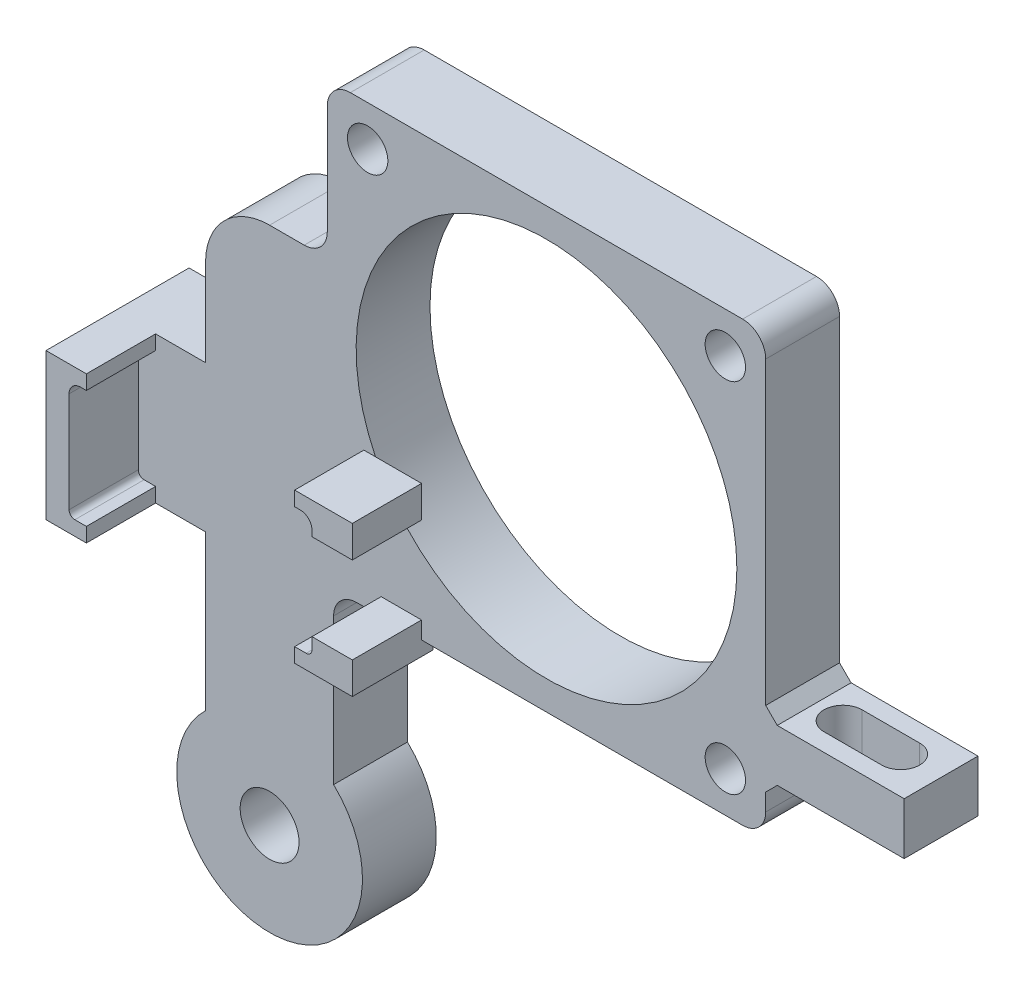
from build123d import *
from OCP.BRepFilletAPI import BRepFilletAPI_MakeFillet

# Parameters (mm, degrees)
SKETCH1_R                 = 2.55
SKETCH1_R_2               = 1.75
SKETCH1_R_3               = 12.5
BOSS_EXTRUDE3_DEPTH       = 6.4
SKETCH1_5_R               = 2.55
BOSS_EXTRUDE2_DEPTH       = 1
CUT_EXTRUDE1_DEPTH        = 10
FILLET2_R                 = 2
CHAMFER2_SIZE             = 1
FILLET1_R                 = 2
SKETCH5_R                 = 16.5
CUT_EXTRUDE2_DEPTH        = 10
SKETCH6_W                 = 4.33
SKETCH6_H                 = 1.25
BOSS_EXTRUDE5_DEPTH       = 6.4
BOSS_EXTRUDE8_DEPTH       = 6
BOSS_EXTRUDE13_DEPTH      = 6
BOSS_EXTRUDE13_DEPTH_BACK = 1
FILLET3_R1                = 1
FILLET3_R2                = 0.5


with BuildPart() as part:
    # Sketch1 → Boss-Extrude3 (new body)
    with BuildSketch(Plane.XY):
        with BuildLine():
            ThreePointArc((-5.55, 5.830951895), (0, -8.05), (5.55, 5.830951895))
            Line((5.55, 5.830951895), (5.55, 20.5))
            Line((5.55, 20.5), (43, 20.5))
            Line((43, 20.5), (43, 25))
            Line((43, 25), (55, 25))
            Line((55, 25), (55, 29.5))
            Line((55, 29.5), (43, 29.5))
            Line((43, 29.5), (43, 58.5))
            Line((43, 58.5), (5, 58.5))
            Line((5, 58.5), (5, 45.05))
            Line((5, 45.05), (0, 45.05))
            ThreePointArc((0, 45.05), (-3.924442636, 43.424442636), (-5.55, 39.5))
            Line((-5.55, 39.5), (-5.55, 5.830951895))
        make_face()
        Circle(SKETCH1_R, mode=Mode.SUBTRACT)
        with Locations((39.5, 24)):
            Circle(SKETCH1_R_2, mode=Mode.SUBTRACT)
        with Locations((8.5, 55)):
            Circle(SKETCH1_R_2, mode=Mode.SUBTRACT)
        with Locations((24, 39.5)):
            Circle(SKETCH1_R_3, mode=Mode.SUBTRACT)
        with Locations((39.5, 55)):
            Circle(SKETCH1_R_2, mode=Mode.SUBTRACT)
    extrude(amount=BOSS_EXTRUDE3_DEPTH)

    # Sketch1<5> → Boss-Extrude2 (add)
    # profile 1 of 2: a face of its own
    with BuildSketch(Plane.XY):
        with BuildLine():
            Line((-5.55, 5.830951895), (-5.55, 0))
            ThreePointArc((-5.55, 0), (0, -5.55), (5.55, 0))
            Line((5.55, 0), (5.55, 5.830951895))
            ThreePointArc((5.55, 5.830951895), (0, 8.05), (-5.55, 5.830951895))
        make_face()
        Circle(SKETCH1_5_R, mode=Mode.SUBTRACT)
    # profile 2 of 2: a face of its own
    with BuildSketch(Plane.XY):
        with BuildLine():
            ThreePointArc((5.55, 0), (0, -5.55), (-5.55, 0))
            Line((-5.55, 0), (-5.55, 5.830951895))
            ThreePointArc((-5.55, 5.830951895), (-3.172144385, -7.398648525), (8.05, 0))
            ThreePointArc((8.05, 0), (7.398648525, 3.172144385), (5.55, 5.830951895))
            Line((5.55, 5.830951895), (5.55, 0))
        make_face()
    extrude(amount=BOSS_EXTRUDE2_DEPTH)

    # Sketch3 → Cut-Extrude1 (cut)
    with BuildSketch(Plane(origin=(0, 29.5, 0), x_dir=(1, 0, 0), z_dir=(0, 1, 0))):
        with BuildLine():
            Line((46.5, -1.55), (51.5, -1.55))
            ThreePointArc((51.5, -1.55), (53.15, -3.2), (51.5, -4.85))
            Line((51.5, -4.85), (46.5, -4.85))
            ThreePointArc((46.5, -4.85), (44.85, -3.2), (46.5, -1.55))
        make_face()
    extrude(amount=-CUT_EXTRUDE1_DEPTH, mode=Mode.SUBTRACT)

    # Fillet2
    fillet2_edges = [part.edges().sort_by_distance(p)[0] for p in [
        (5.55, 20.5, 3.2),
        (5, 45.05, 3.2),
    ]]
    fillet(fillet2_edges, radius=FILLET2_R)

    # Chamfer2
    chamfer2_edges = [part.edges().sort_by_distance(p)[0] for p in [
        (43, 29.5, 3.2),
        (43, 25, 3.2),
    ]]
    chamfer(chamfer2_edges, length=CHAMFER2_SIZE)

    # Fillet1
    fillet1_edges = [part.edges().sort_by_distance(p)[0] for p in [
        (43, 20.5, 3.2),
        (5, 58.5, 3.2),
        (43, 58.5, 3.2),
    ]]
    fillet(fillet1_edges, radius=FILLET1_R)

    # Sketch5 → Cut-Extrude2 (cut)
    with BuildSketch(Plane.XY.offset(6.4)):
        with Locations((24, 39.5)):
            Circle(SKETCH5_R)
    extrude(amount=-CUT_EXTRUDE2_DEPTH, mode=Mode.SUBTRACT)

    # Sketch6 → Boss-Extrude5 (add)
    with BuildSketch(Plane.XY.offset(6.4)):
        with Locations((-7.715, 31.325)):
            Rectangle(SKETCH6_W, SKETCH6_H)
        with BuildLine():
            Line((-5.55, 24.637668909), (-5.55, 30.45))
            Line((-5.55, 30.45), (-10.13, 30.45))
            ThreePointArc((-10.13, 30.45), (-10.837106781, 30.157106781), (-11.13, 29.45))
            Line((-11.13, 29.45), (-11.13, 21.25))
            ThreePointArc((-11.13, 21.25), (-10.983553391, 20.896446609), (-10.63, 20.75))
            Line((-10.63, 20.75), (-5.55, 20.75))
            Line((-5.55, 20.75), (-5.55, 21.862331091))
            ThreePointArc((-5.55, 21.862331091), (-7.525, 23.25), (-5.55, 24.637668909))
        make_face()
        with BuildLine():
            Line((-10.13, 30.45), (-5.55, 30.45))
            Line((-5.55, 30.45), (-5.55, 30.7))
            Line((-5.55, 30.7), (-9.88, 30.7))
            Line((-9.88, 30.7), (-11.38, 30.7))
            Line((-11.38, 30.7), (-11.38, 20.5))
            Line((-11.38, 20.5), (-9.88, 20.5))
            Line((-9.88, 20.5), (-5.55, 20.5))
            Line((-5.55, 20.5), (-5.55, 20.75))
            Line((-5.55, 20.75), (-10.63, 20.75))
            ThreePointArc((-10.63, 20.75), (-10.983553391, 20.896446609), (-11.13, 21.25))
            Line((-11.13, 21.25), (-11.13, 29.45))
            ThreePointArc((-11.13, 29.45), (-10.837106781, 30.157106781), (-10.13, 30.45))
        make_face()
        Polygon((-11.38, 30.7), (-9.88, 30.7), (-9.88, 31.95), (-13.38, 31.95), (-13.38, 19.25), (-9.88, 19.25), (-9.88, 20.5), (-11.38, 20.5), align=None)
        with Locations((-7.715, 19.875)):
            Rectangle(SKETCH6_W, SKETCH6_H)
        with BuildLine():
            Line((-5.55, 21.862331091), (-5.55, 24.637668909))
            ThreePointArc((-5.55, 24.637668909), (-7.525, 23.25), (-5.55, 21.862331091))
        make_face()
        with BuildLine():
            ThreePointArc((-4.575, 23.25), (-4.843118689, 24.09797553), (-5.55, 24.637668909))
            Line((-5.55, 24.637668909), (-5.55, 21.862331091))
            ThreePointArc((-5.55, 21.862331091), (-4.843118689, 22.40202447), (-4.575, 23.25))
        make_face()
    extrude(amount=-BOSS_EXTRUDE5_DEPTH)

    # Sketch6<4> → Boss-Extrude8 (add)
    with BuildSketch(Plane.XY.offset(6.4)):
        Polygon((-9.88, 30.7), (-9.88, 31.95), (-13.38, 31.95), (-13.38, 19.25), (-9.88, 19.25), (-9.88, 20.5), (-11.38, 20.5), (-11.38, 30.7), align=None)
        Polygon((8.17, 32.25), (8.17, 31), (9.67, 31), (9.67, 29.5), (13.17, 29.5), (13.17, 32.25), align=None)
    extrude(amount=BOSS_EXTRUDE8_DEPTH)

    # Sketch7 → Boss-Extrude13 (add, two sides: drawn at the far end of the back side and taken through both)
    with BuildSketch(Plane.XY.offset(6.4).offset(-BOSS_EXTRUDE13_DEPTH_BACK)):
        Polygon((9.67, 22), (9.67, 20.5), (8.17, 20.5), (8.17, 19.25), (13.17, 19.25), (13.17, 22), align=None)
    extrude(amount=BOSS_EXTRUDE13_DEPTH + BOSS_EXTRUDE13_DEPTH_BACK)

    # Fillet3: one fillet with a radius per group of edges: ONE call of the kernel's fillet builder (fillet() takes one radius for all edges)
    fillet3_edges_1 = [part.edges().sort_by_distance(p)[0] for p in [
        (-11.38, 30.7, 9.4),
        (9.67, 31, 9.4),
    ]]
    fillet3_edges_2 = [part.edges().sort_by_distance(p)[0] for p in [
        (9.67, 20.5, 9.4),
        (-11.38, 20.5, 9.4),
    ]]
    fillet3 = BRepFilletAPI_MakeFillet(part.part.solid().wrapped)
    for e in fillet3_edges_1:
        fillet3.Add(FILLET3_R1, e.wrapped)
    for e in fillet3_edges_2:
        fillet3.Add(FILLET3_R2, e.wrapped)
    add(Compound.cast(fillet3.Shape()), mode=Mode.REPLACE)


solid = part.part
